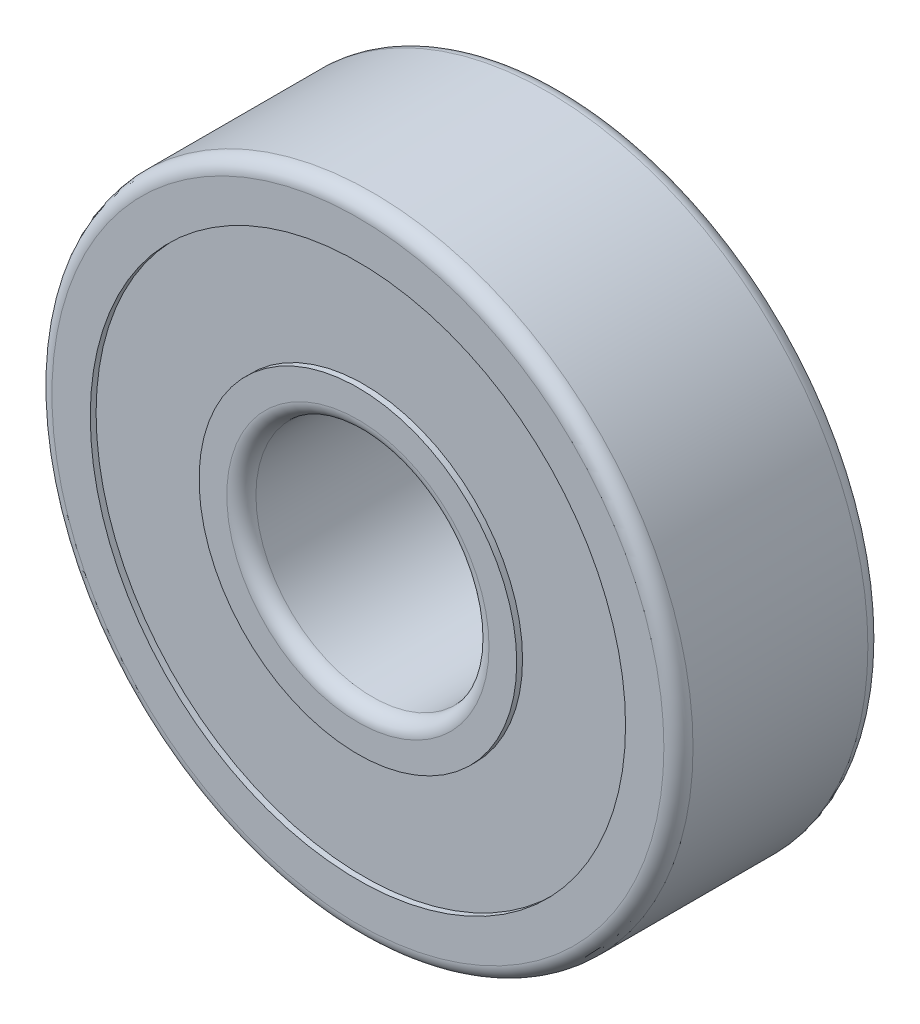
from build123d import *

# Parameters (mm, degrees)
SZKIC1_R                    = 11
SZKIC1_R_2                  = 4
DODANIE_WYCI_GNI_CIE1_DEPTH = 3.5
SZKIC2_R                    = 9.184724544
SZKIC2_R_2                  = 5.450254851
WYTNIJ_WYCI_GNI_CIE1_DEPTH  = 0.2
ZAOKR_GLENIE1_R             = 0.5


with BuildPart() as part:
    # Szkic1 → Dodanie-wyciągnięcie1 (new, symmetric)
    with BuildSketch(Plane.XY):
        Circle(SZKIC1_R)
        Circle(SZKIC1_R_2, mode=Mode.SUBTRACT)
    extrude(amount=DODANIE_WYCI_GNI_CIE1_DEPTH, both=True)

    # Szkic2 → Wytnij-wyciągnięcie1 (cut)
    with BuildSketch(Plane.XY.offset(3.5)):
        Circle(SZKIC2_R)
        Circle(SZKIC2_R_2, mode=Mode.SUBTRACT)
    wytnij_wyci_gni_cie1 = extrude(amount=-WYTNIJ_WYCI_GNI_CIE1_DEPTH, mode=Mode.SUBTRACT)

    # Lustro1: Wytnij-wyciągnięcie1 across plane
    add(wytnij_wyci_gni_cie1.mirror(Plane.XY), mode=Mode.SUBTRACT)

    # Zaokrąglenie1
    zaokr_glenie1_edges = [part.edges().sort_by_distance(p)[0] for p in [
        (-11, 0, -3.5),
        (-11, 0, 3.5),
        (-4, 0, -3.5),
        (-4, 0, 3.5),
    ]]
    fillet(zaokr_glenie1_edges, radius=ZAOKR_GLENIE1_R)


solid = part.part
